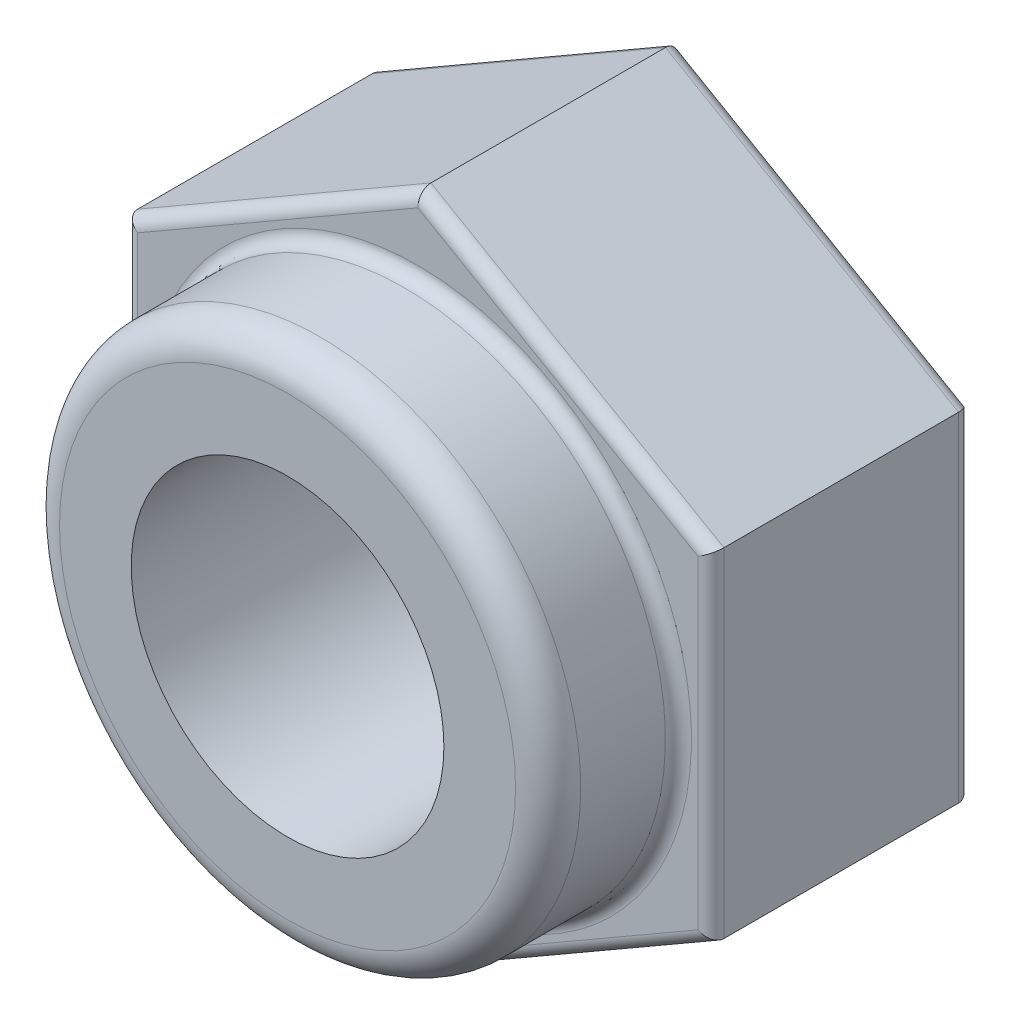
from build123d import *

# Parameters (mm, degrees)
BOSS_EXTRUDE1_DEPTH = 5.08
SKETCH3_R           = 5.08
BOSS_EXTRUDE3_DEPTH = 2.54
FILLET1_R           = 0.635
SKETCH4_R           = 3.048
CUT_EXTRUDE1_DEPTH  = 12.58766262
FILLET2_R           = 0.254
FILLET3_R           = 0.254


with BuildPart() as part:
    # Sketch1 → Boss-Extrude1 (new body)
    with BuildSketch(Plane.XY):
        Polygon((-5.715, 3.299556788), (-5.715, -3.299556788), (0, -6.599113577), (5.715, -3.299556788), (5.715, 3.299556788), (0, 6.599113577), align=None)
    extrude(amount=BOSS_EXTRUDE1_DEPTH)

    # Sketch3 → Boss-Extrude3 (add)
    with BuildSketch(Plane.XY.offset(5.08)):
        Circle(SKETCH3_R)
    extrude(amount=BOSS_EXTRUDE3_DEPTH)

    # Fillet1
    fillet1_edges = [part.edges().sort_by_distance(p)[0] for p in [
        (-5.08, 0, 7.62),
    ]]
    fillet(fillet1_edges, radius=FILLET1_R)

    # Sketch4 → Cut-Extrude1 (cut, through all)
    with BuildSketch(Plane.XY.offset(7.62)):
        Circle(SKETCH4_R)
    extrude(amount=-CUT_EXTRUDE1_DEPTH, mode=Mode.SUBTRACT)

    # Fillet2
    fillet2_edges = [part.edges().sort_by_distance(p)[0] for p in [
        (-3.048, 0, 0),
        (2.8575, 4.949335183, 0),
        (5.715, 0, 0),
        (2.8575, -4.949335183, 0),
        (-2.8575, -4.949335183, 0),
        (-5.715, 0, 0),
        (-2.8575, 4.949335183, 0),
    ]]
    fillet(fillet2_edges, radius=FILLET2_R)

    # Fillet3
    fillet3_edges = [part.edges().sort_by_distance(p)[0] for p in [
        (-2.8575, -4.949335183, 5.08),
        (2.8575, -4.949335183, 5.08),
        (5.715, 0, 5.08),
        (-5.08, 0, 5.08),
        (2.8575, 4.949335183, 5.08),
        (-2.8575, 4.949335183, 5.08),
        (-5.715, 0, 5.08),
    ]]
    fillet(fillet3_edges, radius=FILLET3_R)


solid = part.part
